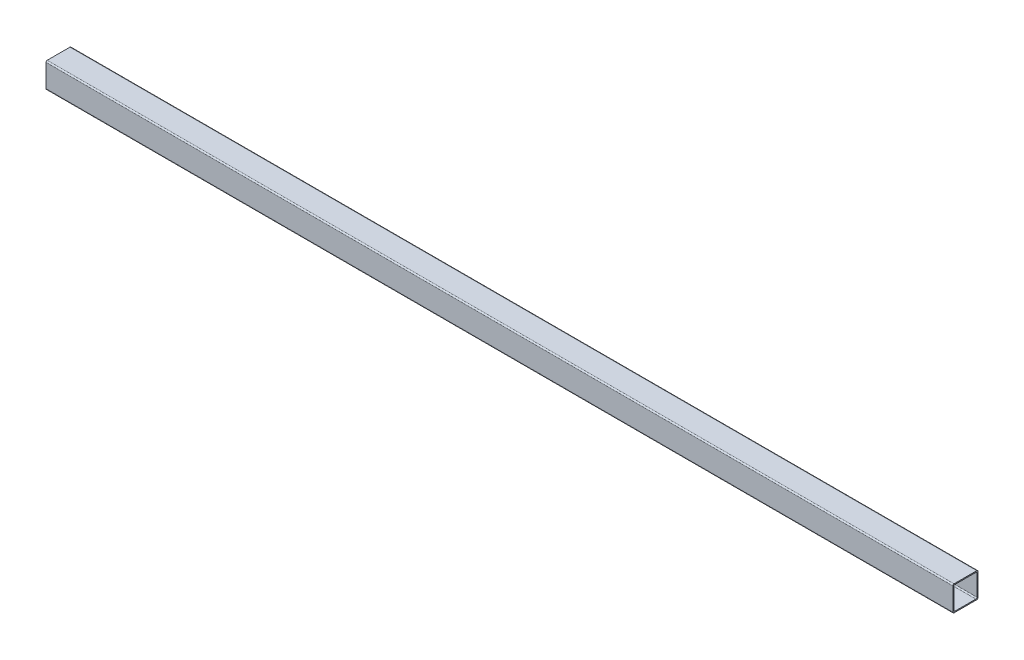
from build123d import *

# Parameters (mm, degrees)
BOSS_EXTRUDE1_DEPTH      = 914.4
BOSS_EXTRUDE1_DEPTH_BACK = 914.4


with BuildPart() as part:
    # Sketch4 → Boss-Extrude1 (new, two sides: drawn at the far end of the back side and taken through both)
    with BuildSketch(Plane(origin=(0, 0, 0), x_dir=(0, 0, -1), z_dir=(1, 0, 0)).offset(-BOSS_EXTRUDE1_DEPTH_BACK)):
        with BuildLine():
            Line((25.4, -22.86), (25.4, 22.86))
            ThreePointArc((25.4, 22.86), (24.656051224, 24.656051224), (22.86, 25.4))
            Line((22.86, 25.4), (-22.86, 25.4))
            ThreePointArc((-22.86, 25.4), (-24.656051224, 24.656051224), (-25.4, 22.86))
            Line((-25.4, 22.86), (-25.4, -22.86))
            ThreePointArc((-25.4, -22.86), (-24.656051224, -24.656051224), (-22.86, -25.4))
            Line((-22.86, -25.4), (22.86, -25.4))
            ThreePointArc((22.86, -25.4), (24.656051224, -24.656051224), (25.4, -22.86))
        make_face()
        with BuildLine():
            Line((23.2918, 20.96262), (23.2918, -20.96262))
            ThreePointArc((23.2918, -20.96262), (22.609598973, -22.609598973), (20.96262, -23.2918))
            Line((20.96262, -23.2918), (-20.96262, -23.2918))
            ThreePointArc((-20.96262, -23.2918), (-22.609598973, -22.609598973), (-23.2918, -20.96262))
            Line((-23.2918, -20.96262), (-23.2918, 20.96262))
            ThreePointArc((-23.2918, 20.96262), (-22.609598973, 22.609598973), (-20.96262, 23.2918))
            Line((-20.96262, 23.2918), (20.96262, 23.2918))
            ThreePointArc((20.96262, 23.2918), (22.609598973, 22.609598973), (23.2918, 20.96262))
        make_face(mode=Mode.SUBTRACT)
    extrude(amount=BOSS_EXTRUDE1_DEPTH + BOSS_EXTRUDE1_DEPTH_BACK)


solid = part.part
